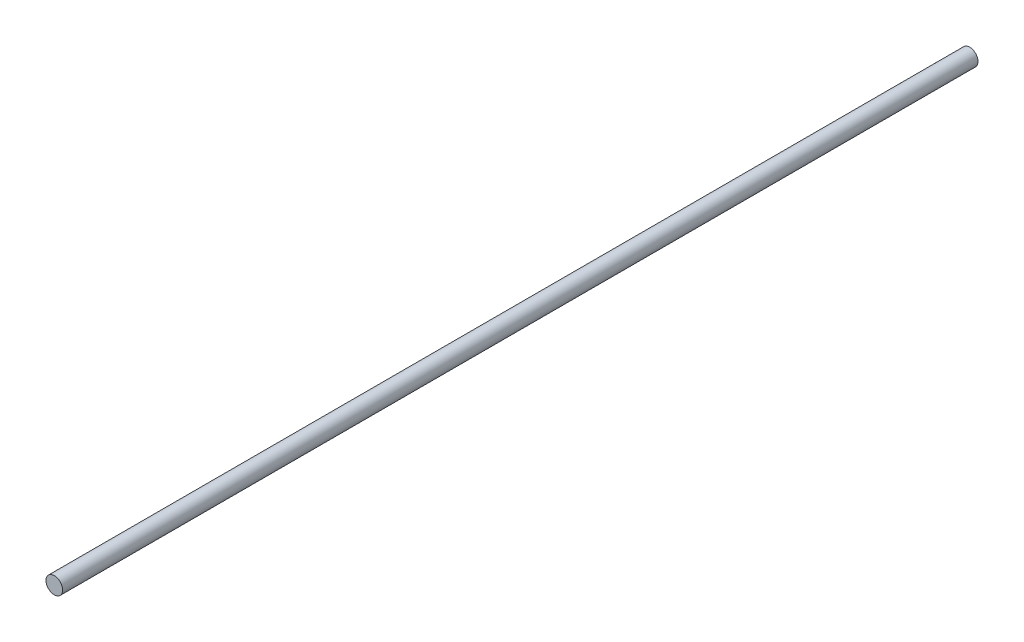
from build123d import *

# Parameters (mm, degrees)
SKETCH1_W = 4
SKETCH1_H = 440


with BuildPart() as part:
    # Sketch1 → Revolve1 (revolve)
    with BuildSketch(Plane(origin=(0, -54.804845013, 0), x_dir=(1, 0, 0), z_dir=(0, 1, 0))):
        with Locations((587.828774839, -592.156699138)):
            Rectangle(SKETCH1_W, SKETCH1_H)
    revolve(axis=Axis((585.828774839, -54.804845013, 372.156699138), (0, 0, 1)))


solid = part.part
